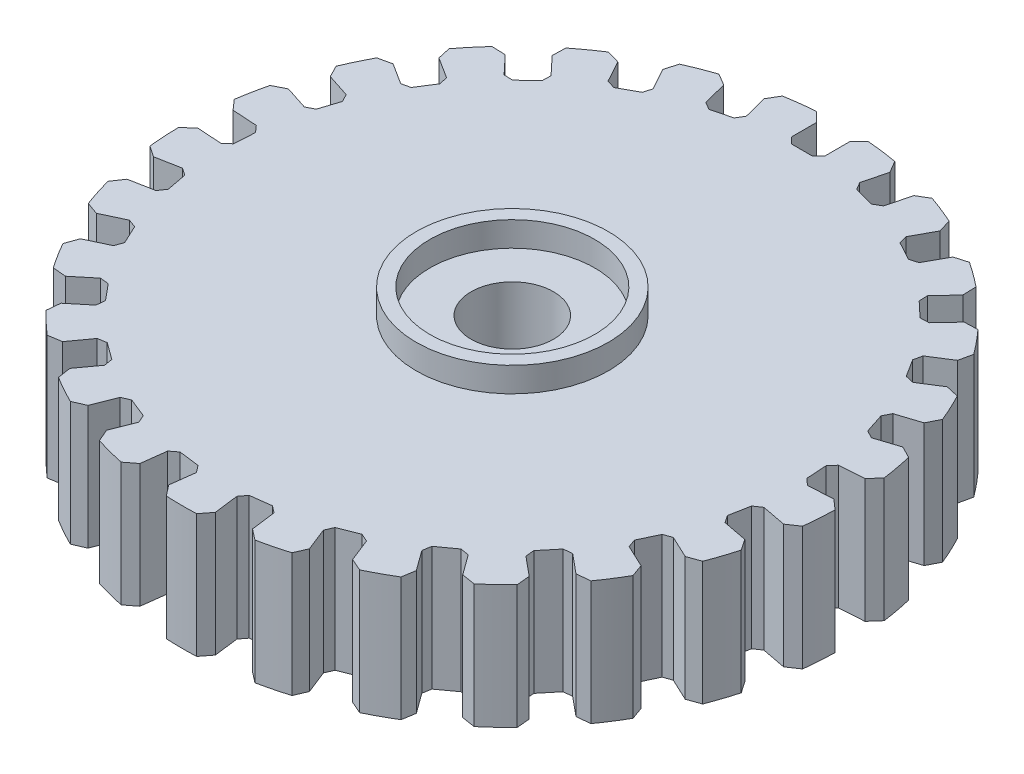
from build123d import *

# Parameters (mm, degrees)
CROQUIS4_R                   = 40
SALIENTE_EXTRUIR2_DEPTH      = 15
CORTAR_EXTRUIR1_DEPTH        = 22
MATRIZC1_COUNT               = 25
SALIENTE_EXTRUIR4_DEPTH      = 18
SALIENTE_EXTRUIR4_DEPTH_BACK = 3
CROQUIS7_R                   = 11.652431428
CROQUIS7_R_2                 = 10
CORTAR_EXTRUIR2_DEPTH        = 28
CORTAR_EXTRUIR2_DEPTH_BACK   = 32
CROQUIS10_R                  = 5


with BuildPart() as part:
    # Croquis4 → Saliente-Extruir2 (new body)
    with BuildSketch(Plane(origin=(0, 0, 0), x_dir=(1, 0, 0), z_dir=(0, 1, 0))):
        with Locations(Location((0, 0, 0), (0, 0, 270))):
            Circle(CROQUIS4_R)
    extrude(amount=SALIENTE_EXTRUIR2_DEPTH)

    # Croquis5 → Cortar-Extruir1 (cut)
    with BuildSketch(Plane(origin=(0, 0, 0), x_dir=(1, 0, 0), z_dir=(0, 1, 0))):
        Polygon((0, 34.948723677), (1.449050807, 34.948723677), (2.202864533, 35.702537403), (2.202864533, 38.715030533), (3.347514698, 39.859680698), (0, 40.825626466), (-2.999317095, 39.887392707), (-1.82695492, 38.715030533), (-1.82695492, 35.702537403), (-1.073141194, 34.948723677), align=None)
    cortar_extruir1 = extrude(amount=CORTAR_EXTRUIR1_DEPTH, mode=Mode.SUBTRACT)

    # MatrizC1: Cortar-Extruir1 ×25 about axis
    matrizc1_axis = Axis((0, 0, 0), (0, 1, 0))
    for i in range(1, MATRIZC1_COUNT):
        add(cortar_extruir1.rotate(matrizc1_axis, i * 360 / MATRIZC1_COUNT), mode=Mode.SUBTRACT)

    # Croquis7 → Saliente-Extruir4 (add, two sides: drawn at the far end of the back side and taken through both)
    with BuildSketch(Plane(origin=(0, 0, 0), x_dir=(1, 0, 0), z_dir=(0, 1, 0)).offset(-SALIENTE_EXTRUIR4_DEPTH_BACK)):
        with Locations(Location((0, 0, 0), (0, 0, 270))):
            Circle(CROQUIS7_R)
        with Locations(Location((0, 0, 0), (0, 0, 270))):
            Circle(CROQUIS7_R_2, mode=Mode.SUBTRACT)
    extrude(amount=SALIENTE_EXTRUIR4_DEPTH + SALIENTE_EXTRUIR4_DEPTH_BACK)

    # Croquis10 → Cortar-Extruir2 (cut, two sides: drawn at the far end of the back side and taken through both)
    with BuildSketch(Plane(origin=(0, 0, 0), x_dir=(1, 0, 0), z_dir=(0, 1, 0)).offset(-CORTAR_EXTRUIR2_DEPTH_BACK)):
        with Locations(Location((0, 0, 0), (0, 0, 270))):
            Circle(CROQUIS10_R)
    extrude(amount=CORTAR_EXTRUIR2_DEPTH + CORTAR_EXTRUIR2_DEPTH_BACK, mode=Mode.SUBTRACT)


solid = part.part
